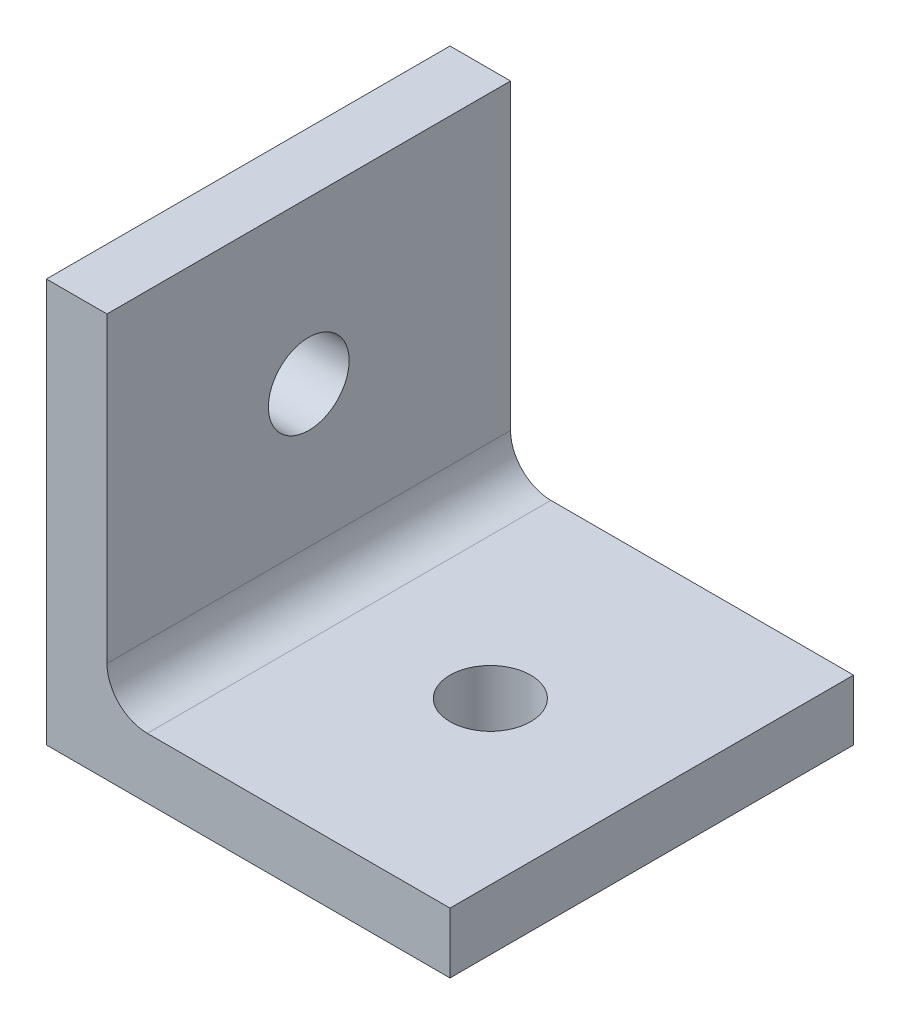
from build123d import *

# Parameters (mm, degrees)
BOSS_EXTRUDE1_DEPTH   = 20
FILLET1_R             = 2
F_4_0MM_DOWEL_HOLE1_D = 4
F_4_0MM_DOWEL_HOLE2_D = 4


with BuildPart() as part:
    # Sketch1 → Boss-Extrude1 (new body)
    with BuildSketch(Plane.XY):
        Polygon((20, 3), (3, 3), (3, 20), (0, 20), (0, 3), (0, 0), (3, 0), (20, 0), align=None)
    extrude(amount=BOSS_EXTRUDE1_DEPTH)

    # Fillet1
    fillet1_edges = [part.edges().sort_by_distance(p)[0] for p in [
        (3, 3, 10),
    ]]
    fillet(fillet1_edges, radius=FILLET1_R)

    # Ø4.0mm Dowel Hole1 (through all)
    with Locations(Plane(origin=(3, 0, 0), x_dir=(0, 0, -1), z_dir=(1, 0, 0))):
        with Locations((-10, 12)):
            Hole(F_4_0MM_DOWEL_HOLE1_D / 2)

    # Ø4.0mm Dowel Hole2 (through all)
    with Locations(Plane(origin=(0, 3, 0), x_dir=(1, 0, 0), z_dir=(0, 1, 0))):
        with Locations((12, -10)):
            Hole(F_4_0MM_DOWEL_HOLE2_D / 2)


solid = part.part
